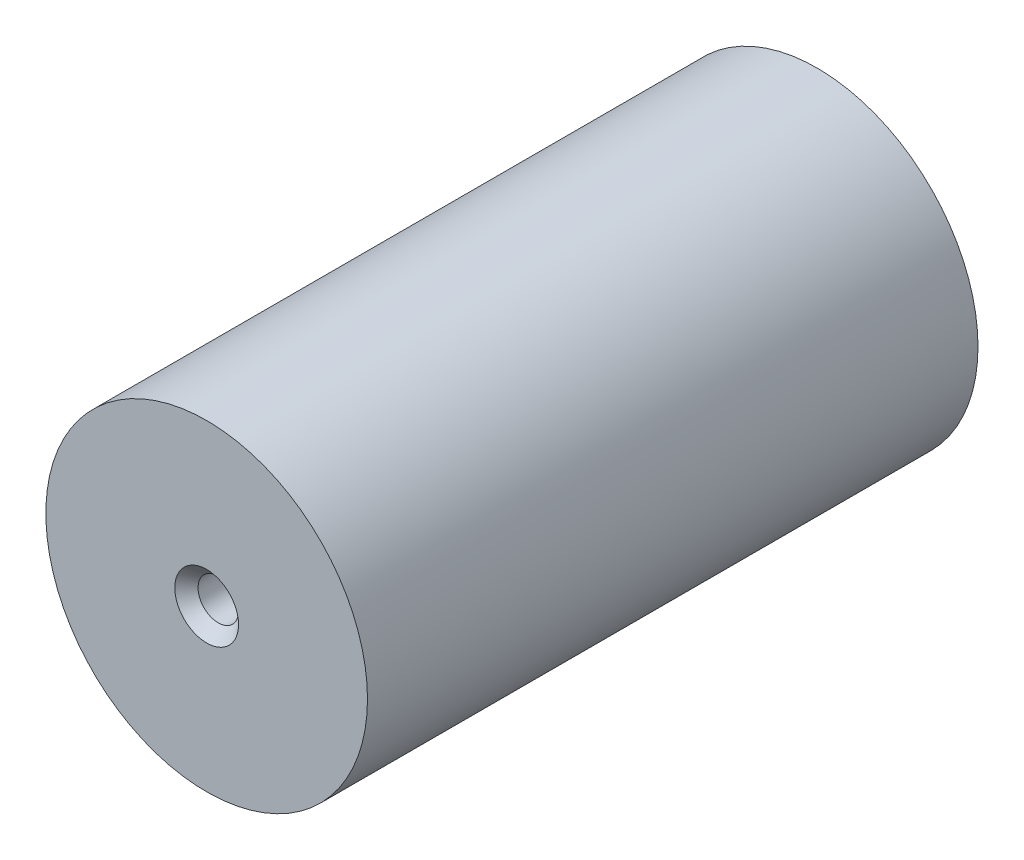
from build123d import *

# Parameters (mm, degrees)
SKETCH1_R                       = 13.716
BOSS_EXTRUDE1_DEPTH             = 52.07
F_8_32_TAPPED_HOLE1_D           = 3.4544
F_8_32_TAPPED_HOLE1_DEPTH       = 12.7
F_8_32_TAPPED_HOLE1_CSINK_D     = 5.4356
F_8_32_TAPPED_HOLE1_CSINK_ANGLE = 90
F_8_32_TAPPED_HOLE1_TIP         = 1.037806461


with BuildPart() as part:
    # Sketch1 → Boss-Extrude1 (new body)
    with BuildSketch(Plane.XY):
        Circle(SKETCH1_R)
    extrude(amount=BOSS_EXTRUDE1_DEPTH)

    # #8-32 Tapped Hole1
    with Locations(Plane(origin=(0, 0, 52.07), x_dir=(-1, 0, 0), z_dir=(0, 0, 1))):
        with Locations((0, 0)):
            CounterSinkHole(F_8_32_TAPPED_HOLE1_D / 2, F_8_32_TAPPED_HOLE1_CSINK_D / 2, depth=F_8_32_TAPPED_HOLE1_DEPTH, counter_sink_angle=F_8_32_TAPPED_HOLE1_CSINK_ANGLE)
            with Locations((0, 0, -(F_8_32_TAPPED_HOLE1_DEPTH + F_8_32_TAPPED_HOLE1_TIP / 2))):  # 118° drill point
                Cone(0, F_8_32_TAPPED_HOLE1_D / 2, F_8_32_TAPPED_HOLE1_TIP, mode=Mode.SUBTRACT)


solid = part.part
